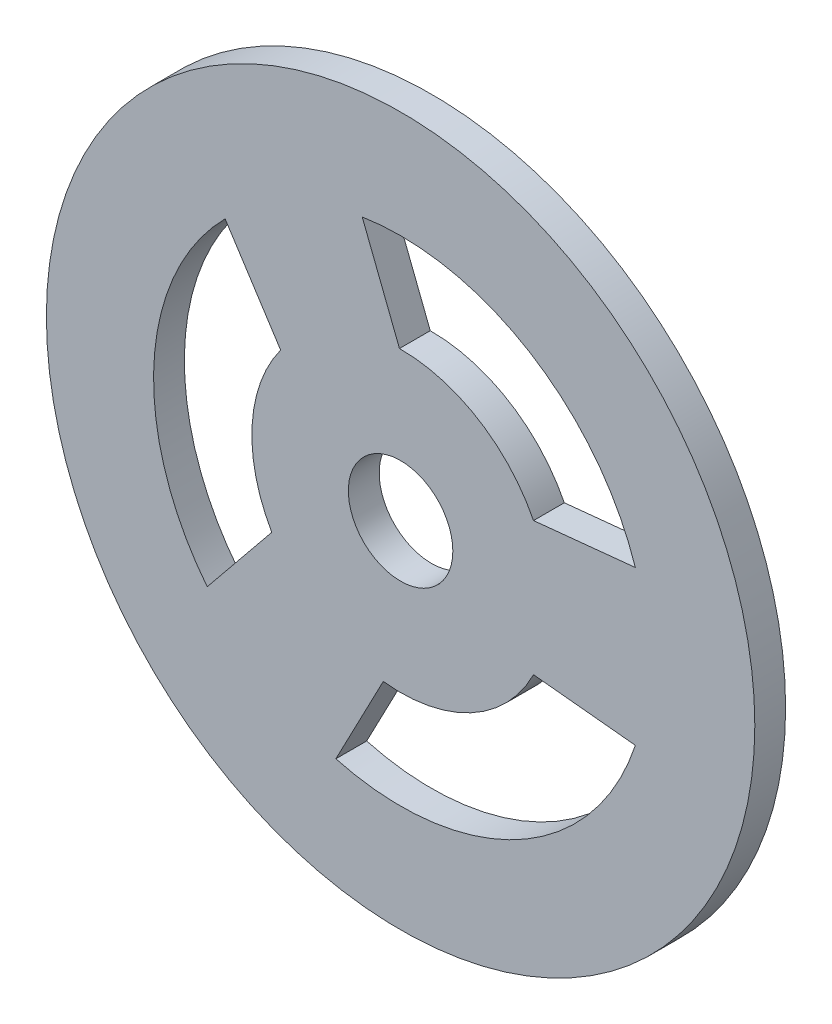
from build123d import *

# Parameters (mm, degrees)
SKETCH1_R          = 34.5
SKETCH1_R_2        = 5.087122698
BASE_EXTRUDE_DEPTH = 3


with BuildPart() as part:
    # Sketch1 → Base-Extrude (new body)
    with BuildSketch(Plane.XY):
        with Locations((255.493849666, -76.580612243)):
            Circle(SKETCH1_R)
        with Locations((255.493849666, -76.580612243)):
            Circle(SKETCH1_R_2, mode=Mode.SUBTRACT)
        with BuildLine():
            Line((268.439049892, -83.080585027), (278.355348881, -84.08056418))
            ThreePointArc((278.355348881, -84.08056418), (266.908732596, -97.760741447), (249.188294551, -99.799944708))
            Line((249.188294551, -99.799944708), (253.805371583, -90.9673039))
            ThreePointArc((253.805371583, -90.9673039), (262.366151463, -89.332056204), (268.439049892, -83.080585027))
        make_face(mode=Mode.SUBTRACT)
        with BuildLine():
            Line((242.946837579, -83.819420347), (236.659216854, -91.552386762))
            ThreePointArc((236.659216854, -91.552386762), (231.469396076, -75.2679603), (238.402528058, -59.645909673))
            Line((238.402528058, -59.645909673), (243.810204365, -68.0178856))
            ThreePointArc((243.810204365, -68.0178856), (241.029987303, -75.790333415), (242.946837579, -83.819420347))
        make_face(mode=Mode.SUBTRACT)
        with BuildLine():
            Line((251.755601813, -52.812504863), (255.382868286, -62.095601431))
            ThreePointArc((255.382868286, -62.095601431), (263.051568152, -64.223074204), (268.439022561, -70.080585027))
            Line((268.439022561, -70.080585027), (278.355317346, -69.08056418))
            ThreePointArc((278.355317346, -69.08056418), (268.047208684, -56.054760182), (251.755601813, -52.812504863))
        make_face(mode=Mode.SUBTRACT)
    extrude(amount=BASE_EXTRUDE_DEPTH)


solid = part.part
